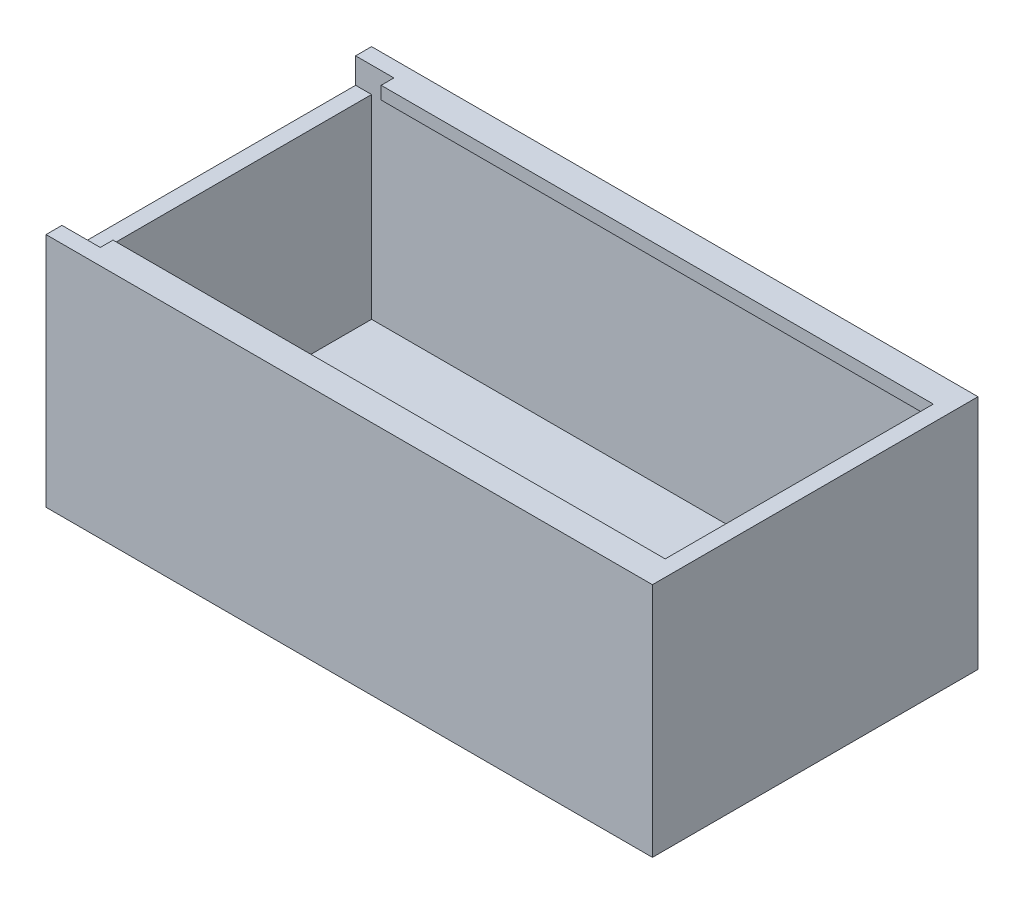
from build123d import *

# Parameters (mm, degrees)
ESBO_O1_W                = 95
ESBO_O1_H                = 51
RESSALTO_EXTRUS_O1_DEPTH = 2.5
ESBO_O2_W                = 95
ESBO_O2_H                = 51
ESBO_O2_W_2              = 90
ESBO_O2_H_2              = 46
RESSALTO_EXTRUS_O3_DEPTH = 37
ESBO_O3_W                = 46
ESBO_O3_H                = 4
CORTE_EXTRUS_O3_DEPTH    = 2.5
RESSALTO_EXTRUS_O7_START = -6
ESBO_O4_W                = 2
ESBO_O4_H                = 2
RESSALTO_EXTRUS_O7_DEPTH = 86.5


with BuildPart() as part:
    # Esboço1 → Ressalto-extrusão1 (new body)
    with BuildSketch(Plane(origin=(0, 0, 0), x_dir=(1, 0, 0), z_dir=(0, 1, 0))):
        with Locations((47.5, -25.5)):
            Rectangle(ESBO_O1_W, ESBO_O1_H)
    extrude(amount=RESSALTO_EXTRUS_O1_DEPTH)

    # Esboço2 → Ressalto-extrusão3 (add)
    with BuildSketch(Plane(origin=(0, 0, 0), x_dir=(1, 0, 0), z_dir=(0, 1, 0))):
        with Locations((47.5, -25.5)):
            Rectangle(ESBO_O2_W, ESBO_O2_H)
        with Locations((47.5, -25.5)):
            Rectangle(ESBO_O2_W_2, ESBO_O2_H_2, mode=Mode.SUBTRACT)
    extrude(amount=RESSALTO_EXTRUS_O3_DEPTH)

    # Esboço3 → Corte-extrusão3 (cut)
    with BuildSketch(Plane.ZY):
        with Locations((25.5, 35)):
            Rectangle(ESBO_O3_W, ESBO_O3_H)
    extrude(amount=-CORTE_EXTRUS_O3_DEPTH, mode=Mode.SUBTRACT)

    # Esboço4 → Ressalto-extrusão7 (add)
    with BuildSketch(Plane.ZY.offset(RESSALTO_EXTRUS_O7_START)):
        with Locations((3.5, 36)):
            Rectangle(ESBO_O4_W, ESBO_O4_H)
        with Locations((47.5, 36)):
            Rectangle(ESBO_O4_W, ESBO_O4_H)
    extrude(amount=-RESSALTO_EXTRUS_O7_DEPTH)


solid = part.part
